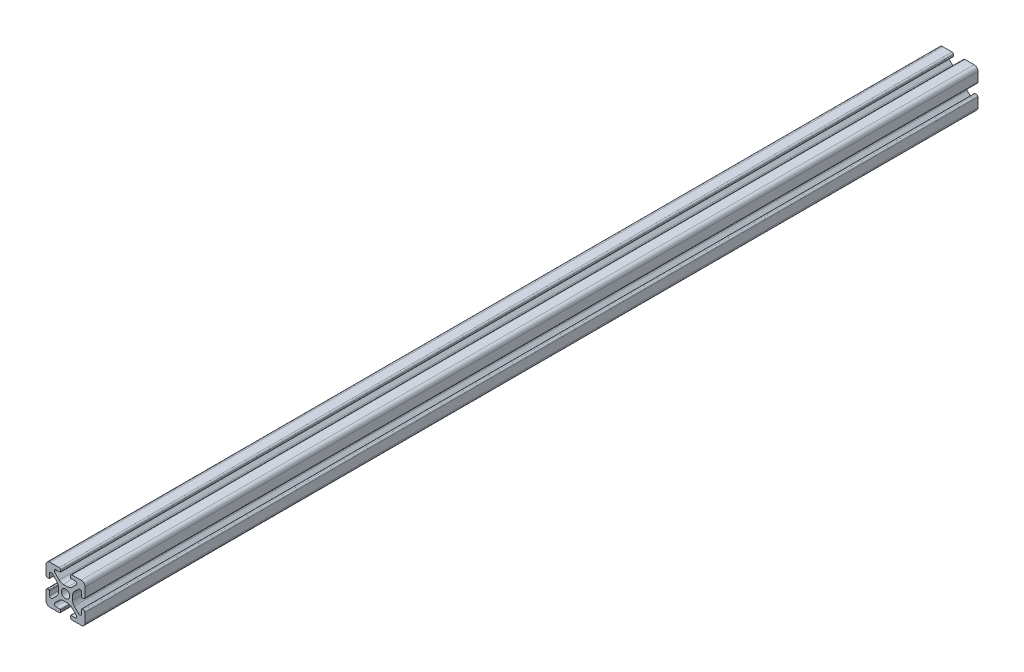
from build123d import *

# Parameters (mm, degrees)
SKETCH1_R           = 2.1463
BOSS_EXTRUDE1_DEPTH = 228.6


with BuildPart() as part:
    # Sketch1 → Boss-Extrude1 (new, symmetric)
    with BuildSketch(Plane.XY):
        with BuildLine():
            Line((-9.9949, 7.9883), (-9.9949, 3.2893))
            ThreePointArc((-9.9949, 3.2893), (-9.76427588, 2.73252412), (-9.2075, 2.5019))
            Line((-9.2075, 2.5019), (-8.4963, 2.5019))
            ThreePointArc((-8.4963, 2.5019), (-8.280773853, 2.591173853), (-8.1915, 2.8067))
            Line((-8.1915, 2.8067), (-8.1915, 4.9149))
            ThreePointArc((-8.1915, 4.9149), (-7.674065253, 5.689295824), (-6.760603096, 5.507596904))
            Line((-6.760603096, 5.507596904), (-4.505765747, 3.252759555))
            ThreePointArc((-4.505765747, 3.252759555), (-3.856054457, 2.280397894), (-3.627906192, 1.133419111))
            Line((-3.627906192, 1.133419111), (-3.627906192, -1.133419111))
            ThreePointArc((-3.627906192, -1.133419111), (-3.856054457, -2.280397894), (-4.505765747, -3.252759555))
            Line((-4.505765747, -3.252759555), (-6.760603096, -5.507596904))
            ThreePointArc((-6.760603096, -5.507596904), (-7.674065253, -5.689295824), (-8.1915, -4.9149))
            Line((-8.1915, -4.9149), (-8.1915, -2.8067))
            ThreePointArc((-8.1915, -2.8067), (-8.280773853, -2.591173853), (-8.4963, -2.5019))
            Line((-8.4963, -2.5019), (-9.2075, -2.5019))
            ThreePointArc((-9.2075, -2.5019), (-9.76427588, -2.73252412), (-9.9949, -3.2893))
            Line((-9.9949, -3.2893), (-9.9949, -7.9883))
            ThreePointArc((-9.9949, -7.9883), (-9.407180467, -9.407180467), (-7.9883, -9.9949))
            Line((-7.9883, -9.9949), (-3.2893, -9.9949))
            ThreePointArc((-3.2893, -9.9949), (-2.73252412, -9.76427588), (-2.5019, -9.2075))
            Line((-2.5019, -9.2075), (-2.5019, -8.4963))
            ThreePointArc((-2.5019, -8.4963), (-2.591173853, -8.280773853), (-2.8067, -8.1915))
            Line((-2.8067, -8.1915), (-4.9149, -8.1915))
            ThreePointArc((-4.9149, -8.1915), (-5.689295824, -7.674065253), (-5.507596904, -6.760603096))
            Line((-5.507596904, -6.760603096), (-3.252759555, -4.505765747))
            ThreePointArc((-3.252759555, -4.505765747), (-2.280397894, -3.856054457), (-1.133419111, -3.627906192))
            Line((-1.133419111, -3.627906192), (1.133419111, -3.627906192))
            ThreePointArc((1.133419111, -3.627906192), (2.280397894, -3.856054457), (3.252759555, -4.505765747))
            Line((3.252759555, -4.505765747), (5.507596904, -6.760603096))
            ThreePointArc((5.507596904, -6.760603096), (5.689295824, -7.674065253), (4.9149, -8.1915))
            Line((4.9149, -8.1915), (2.8067, -8.1915))
            ThreePointArc((2.8067, -8.1915), (2.591173853, -8.280773853), (2.5019, -8.4963))
            Line((2.5019, -8.4963), (2.5019, -9.2075))
            ThreePointArc((2.5019, -9.2075), (2.73252412, -9.76427588), (3.2893, -9.9949))
            Line((3.2893, -9.9949), (7.9883, -9.9949))
            ThreePointArc((7.9883, -9.9949), (9.407180467, -9.407180467), (9.9949, -7.9883))
            Line((9.9949, -7.9883), (9.9949, -3.2893))
            ThreePointArc((9.9949, -3.2893), (9.76427588, -2.73252412), (9.2075, -2.5019))
            Line((9.2075, -2.5019), (8.4963, -2.5019))
            ThreePointArc((8.4963, -2.5019), (8.280773853, -2.591173853), (8.1915, -2.8067))
            Line((8.1915, -2.8067), (8.1915, -4.9149))
            ThreePointArc((8.1915, -4.9149), (7.674065253, -5.689295824), (6.760603096, -5.507596904))
            Line((6.760603096, -5.507596904), (4.505765747, -3.252759555))
            ThreePointArc((4.505765747, -3.252759555), (3.856054457, -2.280397894), (3.627906192, -1.133419111))
            Line((3.627906192, -1.133419111), (3.627906192, 1.133419111))
            ThreePointArc((3.627906192, 1.133419111), (3.856054457, 2.280397894), (4.505765747, 3.252759555))
            Line((4.505765747, 3.252759555), (6.760603096, 5.507596904))
            ThreePointArc((6.760603096, 5.507596904), (7.674065253, 5.689295824), (8.1915, 4.9149))
            Line((8.1915, 4.9149), (8.1915, 2.8067))
            ThreePointArc((8.1915, 2.8067), (8.280773853, 2.591173853), (8.4963, 2.5019))
            Line((8.4963, 2.5019), (9.2075, 2.5019))
            ThreePointArc((9.2075, 2.5019), (9.76427588, 2.73252412), (9.9949, 3.2893))
            Line((9.9949, 3.2893), (9.9949, 7.9883))
            ThreePointArc((9.9949, 7.9883), (9.407180467, 9.407180467), (7.9883, 9.9949))
            Line((7.9883, 9.9949), (3.2893, 9.9949))
            ThreePointArc((3.2893, 9.9949), (2.73252412, 9.76427588), (2.5019, 9.2075))
            Line((2.5019, 9.2075), (2.5019, 8.4963))
            ThreePointArc((2.5019, 8.4963), (2.591173853, 8.280773853), (2.8067, 8.1915))
            Line((2.8067, 8.1915), (4.9149, 8.1915))
            ThreePointArc((4.9149, 8.1915), (5.689295824, 7.674065253), (5.507596904, 6.760603096))
            Line((5.507596904, 6.760603096), (3.252759555, 4.505765747))
            ThreePointArc((3.252759555, 4.505765747), (2.280397894, 3.856054457), (1.133419111, 3.627906192))
            Line((1.133419111, 3.627906192), (-1.133419111, 3.627906192))
            ThreePointArc((-1.133419111, 3.627906192), (-2.280397894, 3.856054457), (-3.252759555, 4.505765747))
            Line((-3.252759555, 4.505765747), (-5.507596904, 6.760603096))
            ThreePointArc((-5.507596904, 6.760603096), (-5.689295824, 7.674065253), (-4.9149, 8.1915))
            Line((-4.9149, 8.1915), (-2.8067, 8.1915))
            ThreePointArc((-2.8067, 8.1915), (-2.591173853, 8.280773853), (-2.5019, 8.4963))
            Line((-2.5019, 8.4963), (-2.5019, 9.2075))
            ThreePointArc((-2.5019, 9.2075), (-2.73252412, 9.76427588), (-3.2893, 9.9949))
            Line((-3.2893, 9.9949), (-7.9883, 9.9949))
            ThreePointArc((-7.9883, 9.9949), (-9.407180467, 9.407180467), (-9.9949, 7.9883))
        make_face()
        Circle(SKETCH1_R, mode=Mode.SUBTRACT)
    extrude(amount=BOSS_EXTRUDE1_DEPTH, both=True)


solid = part.part
